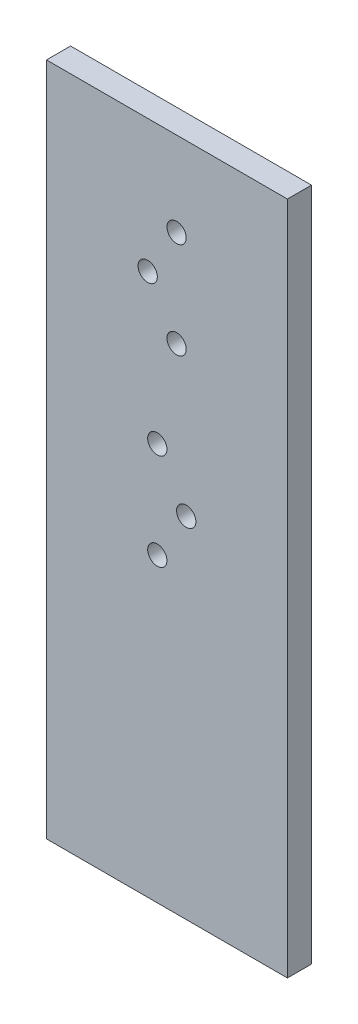
from build123d import *

# Parameters (mm, degrees)
SKETCH_1_W          = 50
SKETCH_1_H          = 140
EXTRUDE_1_DEPTH     = 5
SKETCH_2_R          = 2
CUT_EXTRUDE_1_DEPTH = 5


with BuildPart() as part:
    # 草图1 → 凸台-拉伸1 (new body)
    with BuildSketch(Plane.XY):
        Rectangle(SKETCH_1_W, SKETCH_1_H)
    extrude(amount=EXTRUDE_1_DEPTH)

    # 草图2 → 切除-拉伸1 (cut)
    with BuildSketch(Plane.XY.offset(5)):
        with Locations((-2, 12.5)):
            Circle(SKETCH_2_R)
        with Locations((-2, -7.5)):
            Circle(SKETCH_2_R)
        with Locations((4, 2.5)):
            Circle(SKETCH_2_R)
        with Locations((2, 52.5)):
            Circle(SKETCH_2_R)
        with Locations((2, 32.5)):
            Circle(SKETCH_2_R)
        with Locations((-4, 42.5)):
            Circle(SKETCH_2_R)
    extrude(amount=-CUT_EXTRUDE_1_DEPTH, mode=Mode.SUBTRACT)


solid = part.part
